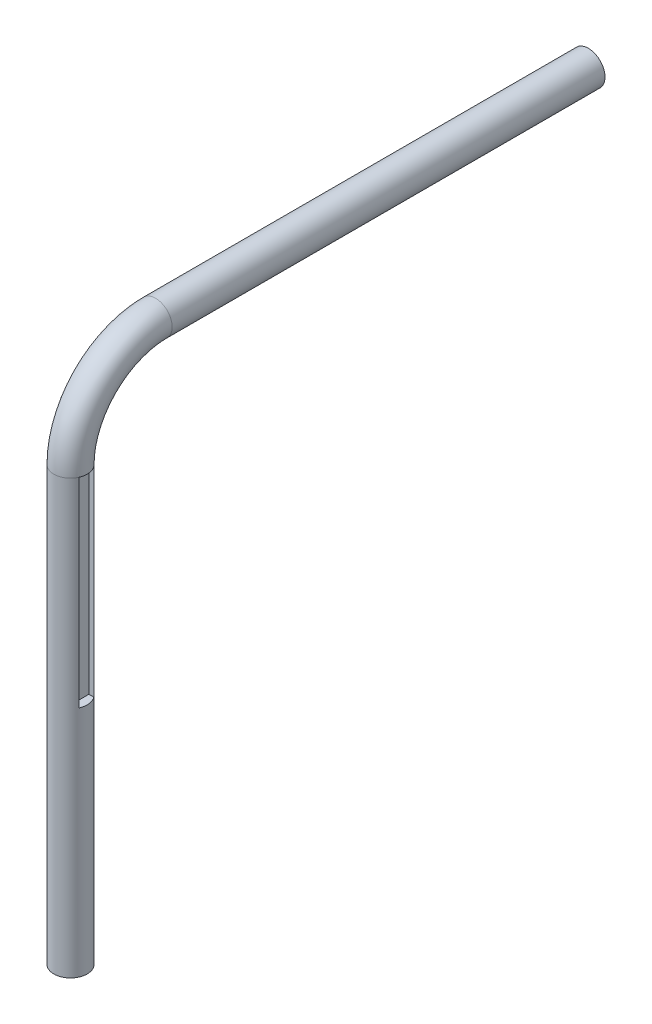
from build123d import *

# Parameters (mm, degrees)
SKETCH3_R           = 12.7
SKETCH4_R           = 12.7
BOSS_EXTRUDE3_DEPTH = 330.2
SKETCH5_R           = 12.7
BOSS_EXTRUDE4_DEPTH = 330.2
SKETCH7_W           = 12.7
SKETCH7_H           = 152.4
CUT_EXTRUDE2_DEPTH  = 6.35


with BuildPart() as part:
    # Sweep1: sweep along a path in Sketch2
    with BuildLine(Plane(origin=(0, 0, 0), x_dir=(0, 0, -1), z_dir=(1, 0, 0))) as sweep1_path:
        ThreePointArc((-64.833774642, 0), (-45.844401699, 45.844401699), (0, 64.833774642))
    # Sketch3 → Sweep1 (sweep)
    with BuildSketch(Plane(origin=(0, 0, 0), x_dir=(1, 0, 0), z_dir=(0, 1, 0))):
        with Locations((0, -64.833774642)):
            Circle(SKETCH3_R)
    sweep(path=sweep1_path.line)

    # Sketch4 → Boss-Extrude3 (add)
    with BuildSketch(Plane(origin=(0, 0, 0), x_dir=(-1, 0, 0), z_dir=(0, -1, 0))):
        with Locations(Location((0, -64.833774642, 0), (0, 0, 90))):
            Circle(SKETCH4_R)
    extrude(amount=BOSS_EXTRUDE3_DEPTH)

    # Sketch5 → Boss-Extrude4 (add)
    with BuildSketch(Plane(origin=(0, 0, 0), x_dir=(-1, 0, 0), z_dir=(0, 0, -1))):
        with Locations(Location((0, 64.833774642, 0), (0, 0, 90))):
            Circle(SKETCH5_R)
    extrude(amount=BOSS_EXTRUDE4_DEPTH)

    # Sketch7 → Cut-Extrude2 (cut)
    with BuildSketch(Plane(origin=(12.7, 0, 0), x_dir=(0, 0, -1), z_dir=(1, 0, 0))):
        with Locations((-63.5, -76.2)):
            Rectangle(SKETCH7_W, SKETCH7_H)
    extrude(amount=-CUT_EXTRUDE2_DEPTH, mode=Mode.SUBTRACT)


solid = part.part
